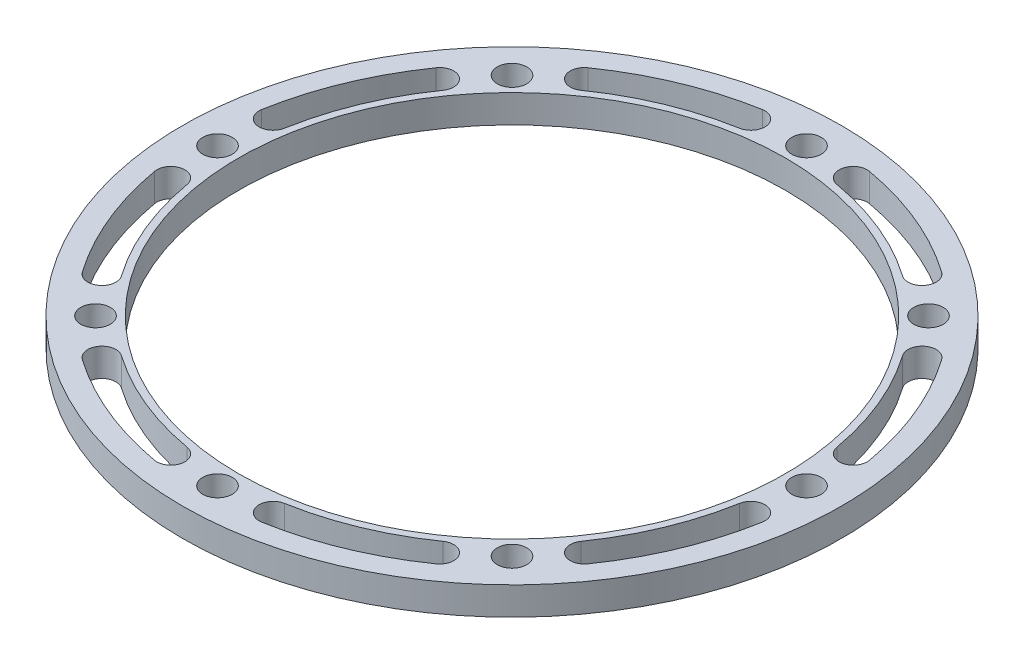
from build123d import *

# Parameters (mm, degrees)
SKETCH_1_W          = 8
SKETCH_1_H          = 4
SKETCH_2_R          = 2.1
CUT_EXTRUDE_1_DEPTH = 10
CUT_EXTRUDE_2_DEPTH = 67.588287258


with BuildPart() as part:
    # 草图1 → 旋转1 (revolve)
    with BuildSketch(Plane.XY, mode=Mode.PRIVATE) as revolve_1_sk:
        with Locations((-43, 2)):
            Rectangle(SKETCH_1_W, SKETCH_1_H)
    revolve(revolve_1_sk.sketch.rotate(Axis((0, 0, 0), (0, 1, 0)), 270), axis=Axis((0, 0, 0), (0, 1, 0)))

    # 草图2 → 切除-拉伸1 (cut)
    with BuildSketch(Plane.XZ):
        with Locations(Location((0, 42, 0), (0, 0, 270))):
            Circle(SKETCH_2_R)
        with Locations(Location((29.69848481, 29.69848481, 0), (0, 0, 270))):
            Circle(SKETCH_2_R)
        with Locations(Location((42, 0, 0), (0, 0, 270))):
            Circle(SKETCH_2_R)
        with Locations(Location((29.69848481, -29.69848481, 0), (0, 0, 270))):
            Circle(SKETCH_2_R)
        with Locations(Location((0, -42, 0), (0, 0, 270))):
            Circle(SKETCH_2_R)
        with Locations(Location((-29.69848481, -29.69848481, 0), (0, 0, 270))):
            Circle(SKETCH_2_R)
        with Locations(Location((-42, 0, 0), (0, 0, 270))):
            Circle(SKETCH_2_R)
        with Locations(Location((-29.69848481, 29.69848481, 0), (0, 0, 270))):
            Circle(SKETCH_2_R)
    extrude(amount=-CUT_EXTRUDE_1_DEPTH, mode=Mode.SUBTRACT)

    # 草图3 → 切除-拉伸2 (cut, through all)
    with BuildSketch(Plane(origin=(0, 4, 0), x_dir=(1, 0, 0), z_dir=(0, 1, 0))):
        with BuildLine():
            ThreePointArc((25.237363199, 36.042689949), (16.838071024, 40.65069943), (7.640519817, 43.331541133))
            ThreePointArc((7.640519817, 43.331541133), (5.323607956, 41.709221982), (6.945927107, 39.39231012))
            ThreePointArc((6.945927107, 39.39231012), (15.307337295, 36.9551813), (22.943057454, 32.766081772))
            ThreePointArc((22.943057454, 32.766081772), (25.728514415, 33.257232987), (25.237363199, 36.042689949))
        make_face()
        with BuildLine():
            ThreePointArc((43.331541133, 7.640519817), (40.65069943, 16.838071024), (36.042689949, 25.237363199))
            ThreePointArc((36.042689949, 25.237363199), (33.257232987, 25.728514415), (32.766081772, 22.943057454))
            ThreePointArc((32.766081772, 22.943057454), (36.9551813, 15.307337295), (39.39231012, 6.945927107))
            ThreePointArc((39.39231012, 6.945927107), (41.709221982, 5.323607956), (43.331541133, 7.640519817))
        make_face()
        with BuildLine():
            ThreePointArc((36.042689949, -25.237363199), (40.65069943, -16.838071024), (43.331541133, -7.640519817))
            ThreePointArc((43.331541133, -7.640519817), (41.709221982, -5.323607956), (39.39231012, -6.945927107))
            ThreePointArc((39.39231012, -6.945927107), (36.9551813, -15.307337295), (32.766081772, -22.943057454))
            ThreePointArc((32.766081772, -22.943057454), (33.257232987, -25.728514415), (36.042689949, -25.237363199))
        make_face()
        with BuildLine():
            ThreePointArc((7.640519817, -43.331541133), (16.838071024, -40.65069943), (25.237363199, -36.042689949))
            ThreePointArc((25.237363199, -36.042689949), (25.728514415, -33.257232987), (22.943057454, -32.766081772))
            ThreePointArc((22.943057454, -32.766081772), (15.307337295, -36.9551813), (6.945927107, -39.39231012))
            ThreePointArc((6.945927107, -39.39231012), (5.323607956, -41.709221982), (7.640519817, -43.331541133))
        make_face()
        with BuildLine():
            ThreePointArc((-25.237363199, -36.042689949), (-16.838071024, -40.65069943), (-7.640519817, -43.331541133))
            ThreePointArc((-7.640519817, -43.331541133), (-5.323607956, -41.709221982), (-6.945927107, -39.39231012))
            ThreePointArc((-6.945927107, -39.39231012), (-15.307337295, -36.9551813), (-22.943057454, -32.766081772))
            ThreePointArc((-22.943057454, -32.766081772), (-25.728514415, -33.257232987), (-25.237363199, -36.042689949))
        make_face()
        with BuildLine():
            ThreePointArc((-43.331541133, -7.640519817), (-40.65069943, -16.838071024), (-36.042689949, -25.237363199))
            ThreePointArc((-36.042689949, -25.237363199), (-33.257232987, -25.728514415), (-32.766081772, -22.943057454))
            ThreePointArc((-32.766081772, -22.943057454), (-36.9551813, -15.307337295), (-39.39231012, -6.945927107))
            ThreePointArc((-39.39231012, -6.945927107), (-41.709221982, -5.323607956), (-43.331541133, -7.640519817))
        make_face()
        with BuildLine():
            ThreePointArc((-36.042689949, 25.237363199), (-40.65069943, 16.838071024), (-43.331541133, 7.640519817))
            ThreePointArc((-43.331541133, 7.640519817), (-41.709221982, 5.323607956), (-39.39231012, 6.945927107))
            ThreePointArc((-39.39231012, 6.945927107), (-36.9551813, 15.307337295), (-32.766081772, 22.943057454))
            ThreePointArc((-32.766081772, 22.943057454), (-33.257232987, 25.728514415), (-36.042689949, 25.237363199))
        make_face()
        with BuildLine():
            ThreePointArc((-7.640519817, 43.331541133), (-16.838071024, 40.65069943), (-25.237363199, 36.042689949))
            ThreePointArc((-25.237363199, 36.042689949), (-25.728514415, 33.257232987), (-22.943057454, 32.766081772))
            ThreePointArc((-22.943057454, 32.766081772), (-15.307337295, 36.9551813), (-6.945927107, 39.39231012))
            ThreePointArc((-6.945927107, 39.39231012), (-5.323607956, 41.709221982), (-7.640519817, 43.331541133))
        make_face()
    extrude(amount=-CUT_EXTRUDE_2_DEPTH, mode=Mode.SUBTRACT)


solid = part.part
